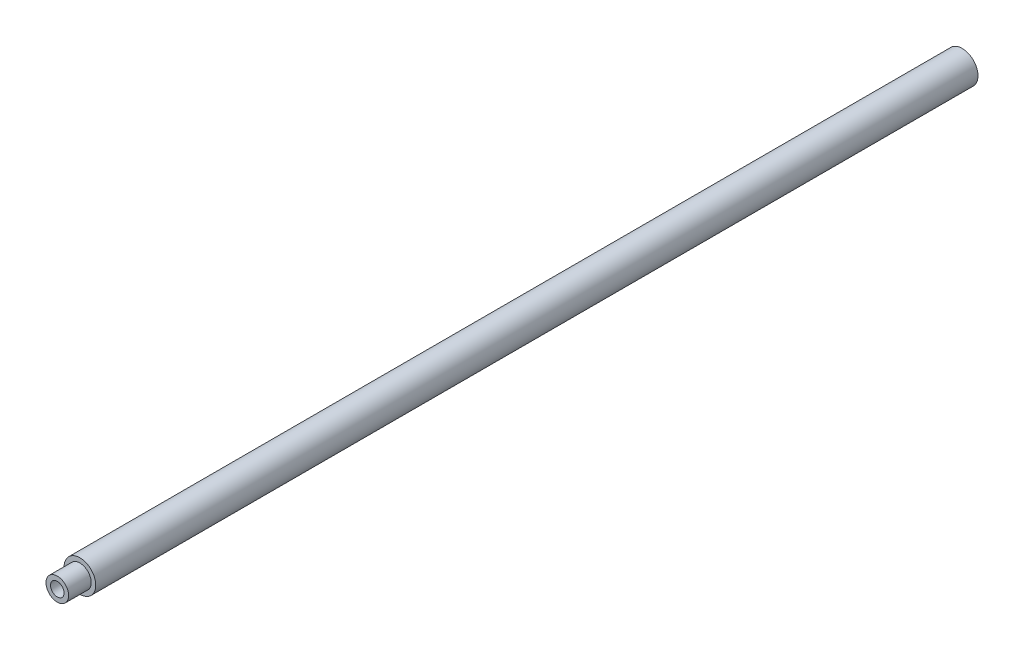
from build123d import *

# Parameters (mm, degrees)
SKETCH1_R           = 3.5
BOSS_EXTRUDE1_DEPTH = 200
SKETCH2_R           = 2
CUT_EXTRUDE1_DEPTH  = 15
CUT_EXTRUDE2_START  = -5
SKETCH3_R           = 3.5
SKETCH3_R_2         = 2.5
CUT_EXTRUDE2_DEPTH  = 5
SKETCH4_R           = 1.5
CUT_EXTRUDE3_DEPTH  = 20


with BuildPart() as part:
    # Sketch1 → Boss-Extrude1 (new body)
    with BuildSketch(Plane.XY):
        Circle(SKETCH1_R)
    extrude(amount=BOSS_EXTRUDE1_DEPTH)

    # Sketch2 → Cut-Extrude1 (cut)
    with BuildSketch(Plane(origin=(0, 0, 0), x_dir=(-1, 0, 0), z_dir=(0, 0, -1))):
        Circle(SKETCH2_R)
    extrude(amount=-CUT_EXTRUDE1_DEPTH, mode=Mode.SUBTRACT)

    # Sketch3 → Cut-Extrude2 (cut)
    with BuildSketch(Plane.XY.offset(200).offset(CUT_EXTRUDE2_START)):
        Circle(SKETCH3_R)
        Circle(SKETCH3_R_2, mode=Mode.SUBTRACT)
    extrude(amount=CUT_EXTRUDE2_DEPTH, mode=Mode.SUBTRACT)

    # Sketch4 → Cut-Extrude3 (cut)
    with BuildSketch(Plane.XY.offset(200)):
        Circle(SKETCH4_R)
    extrude(amount=-CUT_EXTRUDE3_DEPTH, mode=Mode.SUBTRACT)


solid = part.part
